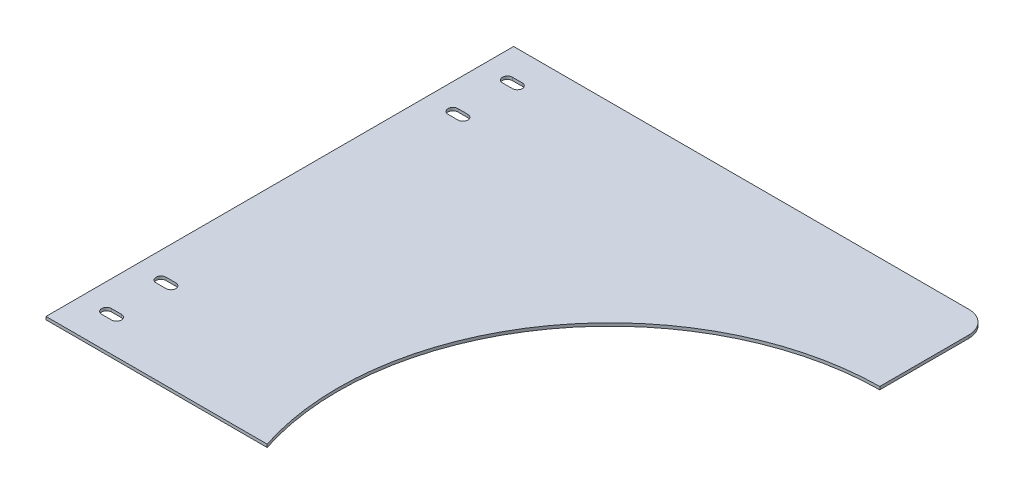
from build123d import *

# Parameters (mm, degrees)
EXTRUDE_1_DEPTH = 1.2


with BuildPart() as part:
    # 스케치1 → 보스-돌출1 (new body)
    with BuildSketch(Plane(origin=(0, 0, 0), x_dir=(1, 0, 0), z_dir=(0, 1, 0))):
        with BuildLine():
            Line((96.5, 48.995454452), (96.5, 85))
            ThreePointArc((96.5, 85), (93.863961031, 91.363961031), (87.5, 94))
            Line((87.5, 94), (-96.5, 94))
            Line((-96.5, 94), (-96.5, -95))
            Line((-96.5, -95), (-7.113574645, -95))
            ThreePointArc((-7.113574645, -95), (8.212657599, 3.247727485), (96.5, 48.995454452))
        make_face()
        with BuildLine():
            ThreePointArc((-86, -83), (-88, -81), (-86, -79))
            Line((-86, -79), (-84, -79))
            Line((-84, -79), (-82, -79))
            ThreePointArc((-82, -79), (-80.585786438, -79.585786438), (-80, -81))
            ThreePointArc((-80, -81), (-80.585786438, -82.414213562), (-82, -83))
            Line((-82, -83), (-84, -83))
            Line((-84, -83), (-86, -83))
        make_face(mode=Mode.SUBTRACT)
        with BuildLine():
            ThreePointArc((-86, -61), (-88, -59), (-86, -57))
            Line((-86, -57), (-84, -57))
            Line((-84, -57), (-82, -57))
            ThreePointArc((-82, -57), (-80.585786438, -57.585786438), (-80, -59))
            ThreePointArc((-80, -59), (-80.585786438, -60.414213562), (-82, -61))
            Line((-82, -61), (-84, -61))
            Line((-84, -61), (-86, -61))
        make_face(mode=Mode.SUBTRACT)
        with BuildLine():
            ThreePointArc((-86, 57), (-88, 59), (-86, 61))
            Line((-86, 61), (-84, 61))
            Line((-84, 61), (-82, 61))
            ThreePointArc((-82, 61), (-80.585786438, 60.414213562), (-80, 59))
            ThreePointArc((-80, 59), (-80.585786438, 57.585786438), (-82, 57))
            Line((-82, 57), (-84, 57))
            Line((-84, 57), (-86, 57))
        make_face(mode=Mode.SUBTRACT)
        with BuildLine():
            ThreePointArc((-86, 79), (-88, 81), (-86, 83))
            Line((-86, 83), (-84, 83))
            Line((-84, 83), (-82, 83))
            ThreePointArc((-82, 83), (-80.585786438, 82.414213562), (-80, 81))
            ThreePointArc((-80, 81), (-80.585786438, 79.585786438), (-82, 79))
            Line((-82, 79), (-84, 79))
            Line((-84, 79), (-86, 79))
        make_face(mode=Mode.SUBTRACT)
    extrude(amount=EXTRUDE_1_DEPTH)


solid = part.part
